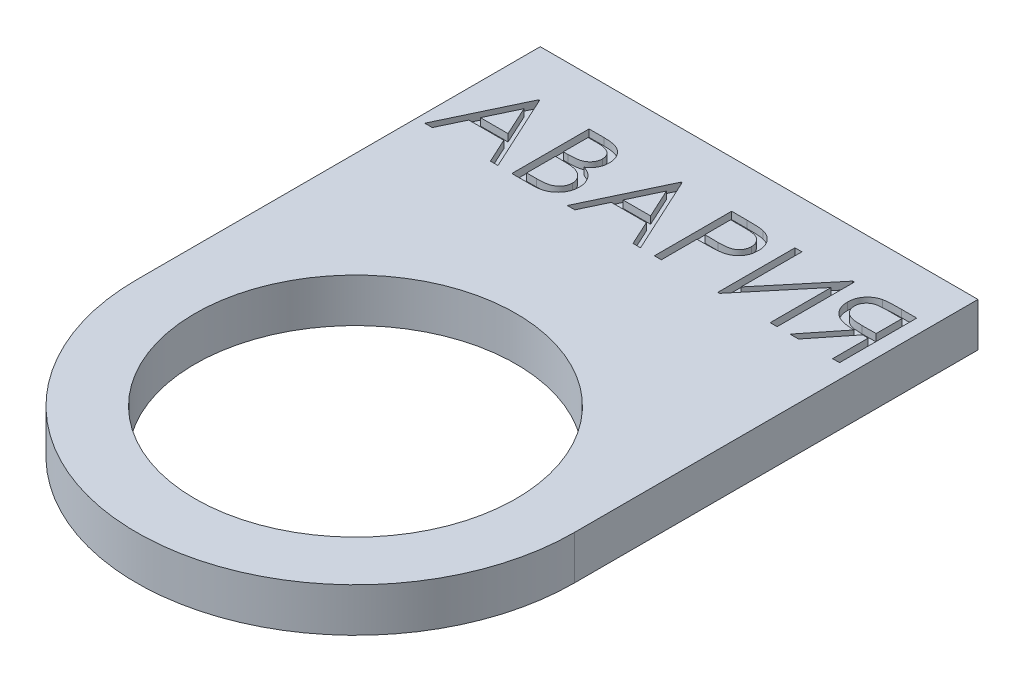
from build123d import *

# Parameters (mm, degrees)
SKETCH1_R           = 11
BOSS_EXTRUDE1_DEPTH = 1.5
CUT_EXTRUDE1_DEPTH  = 0.5


with BuildPart() as part:
    # Sketch1 → Boss-Extrude1 (new, symmetric)
    with BuildSketch(Plane(origin=(0, 0, 0), x_dir=(1, 0, 0), z_dir=(0, 1, 0))):
        with BuildLine():
            Line((15, 17.5), (-15, 17.5))
            Line((-15, 17.5), (-15, -10.16226942))
            ThreePointArc((-15, -10.16226942), (0, -25.16226942), (15, -10.16226942))
            Line((15, -10.16226942), (15, 17.5))
        make_face()
        with Locations(Location((0, -10.16226942, 0), (0, 0, 270))):
            Circle(SKETCH1_R, mode=Mode.SUBTRACT)
    extrude(amount=BOSS_EXTRUDE1_DEPTH, both=True)

    # Sketch2 → Cut-Extrude1 (cut)
    # profile 1 of 6: a face of its own
    with BuildSketch(Plane(origin=(0, 1.5, 0), x_dir=(1, 0, 0), z_dir=(0, 1, 0))):
        with BuildLine():
            Line((14.009348291, 14.291666667), (12.95037894, 14.291666667))
            add(Edge.make_bspline(
                [(12.95037894, 14.291666667), (12.879710805, 14.291431435), (12.744020158, 14.290979766), (12.549629618, 14.288461291), (12.372998174, 14.28124292), (12.214218179, 14.275031133), (12.073292546, 14.263704031), (11.949789142, 14.252877814), (11.84427679, 14.238705732), (11.780405086, 14.225543962), (11.75148571, 14.219584669)],
                knots=[0, 0, 0, 0, 1.410062039, 2.707475311, 3.878576406, 4.937260626, 5.877586885, 6.699081471, 7.410979367, 8, 8, 8, 8], degree=3))
            add(Edge.make_bspline(
                [(11.75148571, 14.219584669), (11.712770252, 14.210020287), (11.63616524, 14.191095558), (11.525881581, 14.151075419), (11.420746044, 14.104839544), (11.321153172, 14.050112283), (11.227093726, 13.987848199), (11.138708539, 13.917683505), (11.056502933, 13.839260878), (10.979844378, 13.754582902), (10.910355864, 13.662910737), (10.850222647, 13.565579798), (10.798730876, 13.463198833), (10.757623446, 13.355411313), (10.724553779, 13.243128404), (10.701228639, 13.125369666), (10.687242315, 13.00266153), (10.685818237, 12.918965709), (10.685096154, 12.876527444)],
                knots=[0, 0, 0, 0, 1.02737288, 2.032829108, 3.019628684, 3.985738875, 4.958353778, 5.924249254, 6.890702889, 7.883913451, 8.865824512, 9.85161466, 10.829249435, 11.81541824, 12.821369441, 13.843154991, 14.906364023, 16, 16, 16, 16], degree=3))
            add(Edge.make_bspline(
                [(10.685096154, 12.876527444), (10.687317081, 12.806019526), (10.691650686, 12.668440316), (10.732057303, 12.468777974), (10.798240287, 12.282523318), (10.889454202, 12.109935551), (11.00555779, 11.954287949), (11.1450879, 11.818039972), (11.307331963, 11.702972348), (11.459079659, 11.624025817), (11.593189216, 11.573228234), (11.703920621, 11.537307445), (11.824801586, 11.510022135), (11.954097889, 11.485223601), (12.092808227, 11.466300327), (12.240653272, 11.452861206), (12.398002793, 11.444219748), (12.505861718, 11.442957195), (12.561348157, 11.442307692)],
                knots=[0, 0, 0, 0, 1.260402266, 2.459371274, 3.627181936, 4.786749125, 5.93865593, 7.087644312, 8.261344208, 9.485713728, 10.136162886, 10.825977872, 11.566646758, 12.35154167, 13.181268117, 14.0701832, 15.007234106, 16, 16, 16, 16], degree=3))
            Line((12.561348157, 11.442307692), (10.617254274, 9))
            Line((10.617254274, 9), (11.20451055, 9))
            Line((11.20451055, 9), (13.148604434, 11.442307692))
            Line((13.148604434, 11.442307692), (13.534455128, 11.442307692))
            Line((13.534455128, 11.442307692), (13.534455128, 9))
            Line((13.534455128, 9), (14.009348291, 9))
            Line((14.009348291, 9), (14.009348291, 14.291666667))
        make_face()
        with BuildLine():
            Line((13.534455128, 13.748931624), (13.534455128, 11.985042735))
            Line((13.534455128, 11.985042735), (12.565588275, 11.977622529))
            add(Edge.make_bspline(
                [(12.565588275, 11.977622529), (12.520352025, 11.977602517), (12.432671291, 11.977563727), (12.305821473, 11.983601935), (12.187711313, 11.990471006), (12.078792528, 12.000977732), (11.979016622, 12.014518533), (11.888432938, 12.03145614), (11.806895333, 12.051190391), (11.71179448, 12.081730056), (11.605632284, 12.130142212), (11.490113624, 12.200458111), (11.392073897, 12.289472449), (11.307544651, 12.389641228), (11.242435603, 12.502039837), (11.195047638, 12.621679325), (11.16530905, 12.747526805), (11.161773552, 12.833965188), (11.159989316, 12.877587473)],
                knots=[0, 0, 0, 0, 1.14660753, 2.222451964, 3.218720504, 4.145691244, 4.995719623, 5.770487122, 6.480909919, 7.121111896, 8.299844659, 9.430703709, 10.534634535, 11.641396424, 12.741395289, 13.810956493, 14.895269934, 16, 16, 16, 16], degree=3))
            add(Edge.make_bspline(
                [(11.159989316, 12.877587473), (11.161779037, 12.920154213), (11.165325611, 13.00450596), (11.195105258, 13.127655798), (11.243195035, 13.244717839), (11.310628031, 13.353460801), (11.392110465, 13.452992503), (11.488882971, 13.536977175), (11.596071967, 13.607309443), (11.696326708, 13.65192597), (11.785874039, 13.67933461), (11.863634486, 13.698598037), (11.951831103, 13.714205201), (12.050252522, 13.726339476), (12.158720683, 13.737258937), (12.277532594, 13.744338826), (12.406551051, 13.748617912), (12.495975958, 13.74882462), (12.542267628, 13.748931624)],
                knots=[0, 0, 0, 0, 1.100801541, 2.181386982, 3.260112282, 4.364594493, 5.481957178, 6.577424609, 7.668452592, 8.790448866, 9.403819393, 10.091598921, 10.863153553, 11.720938239, 12.658472417, 13.685008818, 14.801622349, 16, 16, 16, 16], degree=3))
            Line((12.542267628, 13.748931624), (13.534455128, 13.748931624))
        make_face(mode=Mode.SUBTRACT)
    # profile 2 of 6: a face of its own
    with BuildSketch(Plane(origin=(0, 1.5, 0), x_dir=(1, 0, 0), z_dir=(0, 1, 0))):
        Polygon((9.735309829, 9), (9.260416667, 9), (9.260416667, 13.172275641), (5.78246027, 9), (5.664797009, 9), (5.664797009, 14.291666667), (6.139690171, 14.291666667), (6.139690171, 10.120451055), (9.616586538, 14.291666667), (9.735309829, 14.291666667), align=None)
    # profile 3 of 6: a face of its own
    with BuildSketch(Plane(origin=(0, 1.5, 0), x_dir=(1, 0, 0), z_dir=(0, 1, 0))):
        with BuildLine():
            Line((1.322916667, 14.291666667), (2.36068543, 14.291666667))
            add(Edge.make_bspline(
                [(2.36068543, 14.291666667), (2.432063824, 14.291588204), (2.568827996, 14.291437867), (2.764944807, 14.286879859), (2.943061901, 14.280791884), (3.102795215, 14.272352593), (3.24463622, 14.262379177), (3.36794309, 14.248390974), (3.473685038, 14.233785528), (3.537043599, 14.218936496), (3.565938835, 14.212164463)],
                knots=[0, 0, 0, 0, 1.415646017, 2.712440637, 3.8905458, 4.950247383, 5.884950622, 6.709939814, 7.411656543, 8, 8, 8, 8], degree=3))
            add(Edge.make_bspline(
                [(3.565938835, 14.212164463), (3.602517154, 14.202152706), (3.67481187, 14.182365105), (3.778983685, 14.142732452), (3.878094856, 14.095739178), (3.972485427, 14.042181555), (4.060995481, 13.979761714), (4.144945567, 13.911009935), (4.223594823, 13.834338873), (4.296500975, 13.750608468), (4.363455371, 13.661224342), (4.42110382, 13.564852161), (4.469374746, 13.463114119), (4.510775645, 13.356080981), (4.540572951, 13.242853944), (4.56302005, 13.124219748), (4.577267677, 13.00019111), (4.578632264, 12.915433929), (4.579326923, 12.872287326)],
                knots=[0, 0, 0, 0, 0.999701418, 1.975846123, 2.934577507, 3.890451536, 4.834027766, 5.787354733, 6.749476667, 7.726910423, 8.712836071, 9.690891519, 10.682875813, 11.679750201, 12.712814741, 13.765529915, 14.8625177, 16, 16, 16, 16], degree=3))
            add(Edge.make_bspline(
                [(4.579326923, 12.872287326), (4.578689769, 12.828778069), (4.577443134, 12.743649267), (4.562480893, 12.619109456), (4.542326913, 12.500094748), (4.511337322, 12.386869031), (4.470749221, 12.280104711), (4.423136236, 12.178170229), (4.365708756, 12.082799773), (4.29972193, 11.993647107), (4.226316543, 11.910628549), (4.145803172, 11.834345705), (4.058506861, 11.765245098), (3.964705042, 11.703171817), (3.863483247, 11.649565299), (3.756376657, 11.601551279), (3.642454306, 11.561227175), (3.563619791, 11.540015058), (3.52353766, 11.529230101)],
                knots=[0, 0, 0, 0, 1.121902311, 2.195077645, 3.232258892, 4.234102512, 5.217864754, 6.176164875, 7.132989551, 8.084763148, 9.034132444, 9.988522005, 10.94243251, 11.903244335, 12.886203696, 13.894208494, 14.929344452, 16, 16, 16, 16], degree=3))
            add(Edge.make_bspline(
                [(3.52353766, 11.529230101), (3.49038562, 11.522180118), (3.417730995, 11.50672967), (3.298074736, 11.48948117), (3.158759689, 11.474758845), (2.999976003, 11.46372022), (2.821866207, 11.454270258), (2.624333949, 11.446758973), (2.406991475, 11.442631694), (2.255390903, 11.442418829), (2.176240318, 11.442307692)],
                knots=[0, 0, 0, 0, 0.601384939, 1.31797006, 2.144135048, 3.087295005, 4.142315834, 5.309527816, 6.595305764, 8, 8, 8, 8], degree=3))
            Line((2.176240318, 11.442307692), (1.797809829, 11.442307692))
            Line((1.797809829, 11.442307692), (1.797809829, 9))
            Line((1.797809829, 9), (1.322916667, 9))
            Line((1.322916667, 9), (1.322916667, 14.291666667))
        make_face()
        with BuildLine():
            Line((1.797809829, 13.748931624), (1.797809829, 11.985042735))
            Line((1.797809829, 11.985042735), (2.724275507, 11.973382412))
            add(Edge.make_bspline(
                [(2.724275507, 11.973382412), (2.769511586, 11.973359032), (2.856838902, 11.973313899), (2.982986526, 11.979339177), (3.100021996, 11.986294744), (3.207585818, 11.996478819), (3.305726481, 12.010874054), (3.394607626, 12.025406086), (3.473540065, 12.04642967), (3.565916239, 12.074737167), (3.668851777, 12.123016241), (3.780834856, 12.19309286), (3.875738004, 12.282417265), (3.957862096, 12.382849819), (4.023034078, 12.494578265), (4.070743733, 12.614122967), (4.098776197, 12.74025793), (4.102535085, 12.826569759), (4.104433761, 12.870167268)],
                knots=[0, 0, 0, 0, 1.160613943, 2.240541288, 3.23993089, 4.169200891, 5.011653406, 5.7853311, 6.478053781, 7.106038997, 8.262395093, 9.384106736, 10.481365981, 11.59014053, 12.70357646, 13.786202915, 14.881775077, 16, 16, 16, 16], degree=3))
            add(Edge.make_bspline(
                [(4.104433761, 12.870167268), (4.102524759, 12.91271002), (4.098729901, 12.997279747), (4.070524013, 13.121223825), (4.023126836, 13.239508759), (3.957424604, 13.349837114), (3.877685038, 13.449908282), (3.785006269, 13.536838463), (3.679606458, 13.606721275), (3.581562108, 13.651826356), (3.494474601, 13.679366117), (3.418831043, 13.698635102), (3.333422523, 13.71401965), (3.238221237, 13.726476993), (3.133965072, 13.737141155), (3.019758334, 13.744377097), (2.896033659, 13.748612632), (2.810141486, 13.748822719), (2.765616653, 13.748931624)],
                knots=[0, 0, 0, 0, 1.120700087, 2.227813068, 3.331159281, 4.466773991, 5.599788987, 6.693661531, 7.80175334, 8.91857717, 9.525282508, 10.207424825, 10.974604443, 11.810962634, 12.737642355, 13.736264703, 14.826523623, 16, 16, 16, 16], degree=3))
            Line((2.765616653, 13.748931624), (1.797809829, 13.748931624))
        make_face(mode=Mode.SUBTRACT)
    # profile 4 of 6: a face of its own
    with BuildSketch(Plane(origin=(0, 1.5, 0), x_dir=(1, 0, 0), z_dir=(0, 1, 0))):
        Polygon((-2.06917735, 14.291666667), (0.373130342, 9), (-0.143103966, 9), (-0.925405649, 10.696047009), (-3.324252137, 10.696047009), (-4.128814436, 9), (-4.647168803, 9), (-2.137019231, 14.291666667), align=None)
        Polygon((-2.108398438, 13.26025808), (-3.066664997, 11.238782051), (-1.175572583, 11.238782051), align=None, mode=Mode.SUBTRACT)
    # profile 5 of 6: a face of its own
    with BuildSketch(Plane(origin=(0, 1.5, 0), x_dir=(1, 0, 0), z_dir=(0, 1, 0))):
        with BuildLine():
            Line((-8.446314103, 14.291666667), (-7.413845486, 14.291666667))
            add(Edge.make_bspline(
                [(-7.413845486, 14.291666667), (-7.363304811, 14.291400949), (-7.265344403, 14.290885921), (-7.122893581, 14.28289833), (-6.989469784, 14.272007068), (-6.865034318, 14.254725856), (-6.749644685, 14.233874002), (-6.642953138, 14.208622447), (-6.545298949, 14.178344115), (-6.428711836, 14.13019557), (-6.29578417, 14.058647447), (-6.151853267, 13.952922116), (-6.02877781, 13.823605178), (-5.922662782, 13.677732592), (-5.838296804, 13.517265413), (-5.777262271, 13.346028306), (-5.738621198, 13.166229958), (-5.734647255, 13.042793249), (-5.732638889, 12.980410323)],
                knots=[0, 0, 0, 0, 1.001505555, 1.941167018, 2.826882275, 3.653841531, 4.429895133, 5.150066043, 5.825578002, 6.45369114, 7.647487171, 8.808567382, 9.977351308, 11.170798116, 12.373658725, 13.556498008, 14.765093433, 16, 16, 16, 16], degree=3))
            add(Edge.make_bspline(
                [(-5.732638889, 12.980410323), (-5.734291731, 12.92197134), (-5.737539722, 12.807133228), (-5.768598417, 12.639169515), (-5.817222285, 12.479283743), (-5.884812364, 12.328059423), (-5.972657049, 12.188913365), (-6.076764269, 12.060723093), (-6.202368482, 11.948916138), (-6.296474333, 11.886409607), (-6.344275841, 11.854659121)],
                knots=[0, 0, 0, 0, 1.044552857, 2.05264487, 3.044412934, 4.028983338, 5.005914585, 5.980388656, 6.974128949, 8, 8, 8, 8], degree=3))
            add(Edge.make_bspline(
                [(-6.344275841, 11.854659121), (-6.284161862, 11.831579897), (-6.169148927, 11.787423623), (-6.010873646, 11.709355719), (-5.87450763, 11.624443957), (-5.759002422, 11.531716041), (-5.66021811, 11.431765815), (-5.573959496, 11.323127725), (-5.500357895, 11.204384603), (-5.437291927, 11.076774496), (-5.388081308, 10.941600431), (-5.351227262, 10.800130329), (-5.330109809, 10.652871478), (-5.327104685, 10.552654297), (-5.325587607, 10.502061632)],
                knots=[0, 0, 0, 0, 1.27268992, 2.434971085, 3.483601985, 4.442670788, 5.356604649, 6.2567628, 7.179492994, 8.113709626, 9.066344395, 10.018646069, 10.999752585, 12, 12, 12, 12], degree=3))
            add(Edge.make_bspline(
                [(-5.325587607, 10.502061632), (-5.327064505, 10.450404575), (-5.329970343, 10.348767869), (-5.35140911, 10.199459511), (-5.387708594, 10.05677358), (-5.437709017, 9.919787173), (-5.502966326, 9.788765303), (-5.582383606, 9.663559534), (-5.677076565, 9.545427868), (-5.78300495, 9.433057628), (-5.902841765, 9.332020378), (-6.032133442, 9.242038298), (-6.172508236, 9.168036514), (-6.321660655, 9.105873005), (-6.481263847, 9.058388312), (-6.650601123, 9.025167873), (-6.829526436, 9.002784067), (-6.952307846, 9.000943769), (-7.015274439, 9)],
                knots=[0, 0, 0, 0, 0.978564426, 1.925352924, 2.850884081, 3.763762016, 4.682927383, 5.618979971, 6.567305752, 7.547517671, 8.540179244, 9.531824382, 10.526200242, 11.540722885, 12.589160233, 13.674978461, 14.80764778, 16, 16, 16, 16], degree=3))
            Line((-7.015274439, 9), (-8.446314103, 9))
            Line((-8.446314103, 9), (-8.446314103, 14.291666667))
        make_face()
        with BuildLine():
            Line((-7.97142094, 13.748931624), (-7.97142094, 12.052884615))
            Line((-7.97142094, 12.052884615), (-7.652352097, 12.052884615))
            add(Edge.make_bspline(
                [(-7.652352097, 12.052884615), (-7.605711656, 12.053489261), (-7.51559282, 12.054657559), (-7.385085357, 12.058004186), (-7.263943961, 12.067375038), (-7.152377737, 12.076743196), (-7.050562375, 12.091975013), (-6.958723442, 12.11010596), (-6.875419611, 12.129281305), (-6.779353869, 12.161892315), (-6.670386435, 12.210088324), (-6.554222099, 12.284885029), (-6.451814032, 12.373973039), (-6.365337332, 12.476768898), (-6.294562846, 12.58995944), (-6.245405206, 12.711738653), (-6.212071812, 12.839071471), (-6.209060806, 12.926487163), (-6.207532051, 12.970870059)],
                knots=[0, 0, 0, 0, 1.156816544, 2.235205308, 3.236616184, 4.169592532, 5.011045266, 5.787822928, 6.49130361, 7.128639758, 8.301311294, 9.436451833, 10.541879658, 11.654887649, 12.756523258, 13.837046038, 14.901820046, 16, 16, 16, 16], degree=3))
            add(Edge.make_bspline(
                [(-6.207532051, 12.970870059), (-6.208327586, 13.000239975), (-6.209888113, 13.057852274), (-6.222668702, 13.141837607), (-6.244391106, 13.220825185), (-6.27229224, 13.295897471), (-6.311282281, 13.364707054), (-6.357188946, 13.429633076), (-6.412654215, 13.488464493), (-6.475787295, 13.543451711), (-6.548371761, 13.592202366), (-6.630364309, 13.63489971), (-6.722874249, 13.669281599), (-6.824342494, 13.699392924), (-6.936330924, 13.720541893), (-7.057547213, 13.738160705), (-7.188984229, 13.747130446), (-7.279917896, 13.74831784), (-7.326923077, 13.748931624)],
                knots=[0, 0, 0, 0, 0.91205012, 1.789085906, 2.630437955, 3.453916878, 4.269457761, 5.079663411, 5.91843418, 6.774407191, 7.675494373, 8.627863946, 9.638891023, 10.736472738, 11.911756761, 13.175263542, 14.539845004, 16, 16, 16, 16], degree=3))
            Line((-7.326923077, 13.748931624), (-7.97142094, 13.748931624))
        make_face(mode=Mode.SUBTRACT)
        with BuildLine():
            Line((-7.97142094, 11.510149573), (-7.97142094, 9.542735043))
            Line((-7.97142094, 9.542735043), (-7.295122196, 9.542735043))
            add(Edge.make_bspline(
                [(-7.295122196, 9.542735043), (-7.246712629, 9.543315232), (-7.153409571, 9.544433471), (-7.018696997, 9.548084048), (-6.893839209, 9.556387845), (-6.779405957, 9.569459547), (-6.674161582, 9.583638869), (-6.579368626, 9.602705924), (-6.494258679, 9.624551377), (-6.395570142, 9.658318518), (-6.284439838, 9.710776277), (-6.164680567, 9.789870406), (-6.058202832, 9.884097311), (-5.967782976, 9.993152384), (-5.893680005, 10.111733081), (-5.839772353, 10.237440931), (-5.806524272, 10.368198812), (-5.802499326, 10.457350865), (-5.800480769, 10.502061632)],
                knots=[0, 0, 0, 0, 1.160039823, 2.235823828, 3.228722157, 4.157150951, 4.99529583, 5.772374946, 6.472645482, 7.099169577, 8.269452708, 9.405989375, 10.527446681, 11.663510218, 12.788923519, 13.866172445, 14.929861265, 16, 16, 16, 16], degree=3))
            add(Edge.make_bspline(
                [(-5.800480769, 10.502061632), (-5.800898213, 10.530021802), (-5.801726366, 10.585491141), (-5.814215629, 10.667006724), (-5.832379456, 10.745967271), (-5.855861505, 10.822587188), (-5.890059985, 10.895481221), (-5.929984166, 10.966091044), (-5.976794857, 11.034509995), (-6.049735441, 11.121009473), (-6.155828798, 11.220669719), (-6.306575947, 11.318244276), (-6.477984064, 11.396935603), (-6.602304202, 11.430347907), (-6.666524773, 11.447607839)],
                knots=[0, 0, 0, 0, 0.723448775, 1.435228256, 2.130040452, 2.821711965, 3.505591119, 4.210454504, 4.921174351, 5.648778258, 7.137944449, 8.670945889, 10.280296675, 12, 12, 12, 12], degree=3))
            add(Edge.make_bspline(
                [(-6.666524773, 11.447607839), (-6.692271144, 11.452831597), (-6.748094587, 11.464157782), (-6.839122715, 11.476113476), (-6.943044802, 11.486764936), (-7.060100819, 11.49464371), (-7.190438865, 11.502787651), (-7.334337301, 11.505954821), (-7.491208479, 11.509733464), (-7.60005409, 11.510007322), (-7.656592214, 11.510149573)],
                knots=[0, 0, 0, 0, 0.634451884, 1.375622551, 2.216452059, 3.157844607, 4.20941857, 5.370758133, 6.634282058, 8, 8, 8, 8], degree=3))
            Line((-7.656592214, 11.510149573), (-7.97142094, 11.510149573))
        make_face(mode=Mode.SUBTRACT)
    # profile 6 of 6: a face of its own
    with BuildSketch(Plane(origin=(0, 1.5, 0), x_dir=(1, 0, 0), z_dir=(0, 1, 0))):
        Polygon((-11.83840812, 14.291666667), (-9.396100427, 9), (-9.912334736, 9), (-10.694636418, 10.696047009), (-13.093482906, 10.696047009), (-13.898045206, 9), (-14.416399573, 9), (-11.90625, 14.291666667), align=None)
        Polygon((-11.877629207, 13.26025808), (-12.835895767, 11.238782051), (-10.944803352, 11.238782051), align=None, mode=Mode.SUBTRACT)
    extrude(amount=-CUT_EXTRUDE1_DEPTH, mode=Mode.SUBTRACT)


solid = part.part
